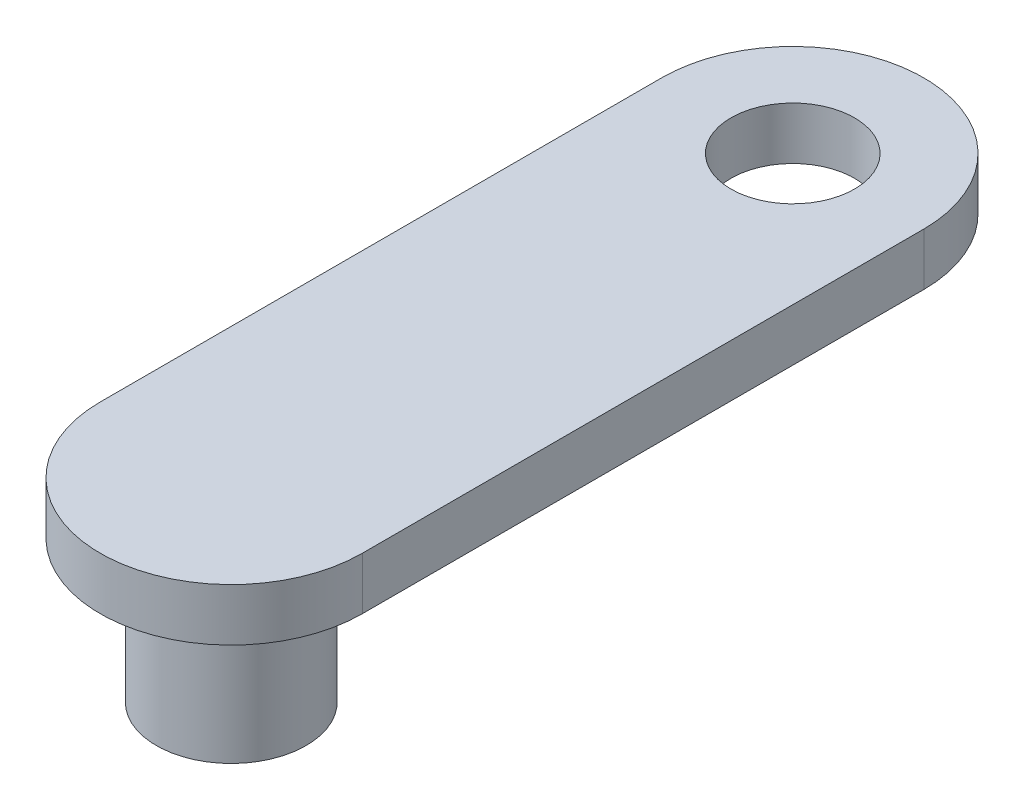
from build123d import *

# Parameters (mm, degrees)
SKETCH_1_R      = 2
EXTRUDE_1_DEPTH = 3.8
SKETCH_2_R      = 1.65
EXTRUDE_2_DEPTH = 1.4


with BuildPart() as part:
    # 草图1 → 凸台-拉伸1 (new body)
    with BuildSketch(Plane(origin=(0, 0, 0), x_dir=(1, 0, 0), z_dir=(0, 1, 0))):
        with Locations(Location((0, 0, 0), (0, 0, 90))):
            Circle(SKETCH_1_R)
    extrude(amount=EXTRUDE_1_DEPTH)

    # 草图2 → 凸台-拉伸2 (add)
    with BuildSketch(Plane(origin=(0, 3.8, 0), x_dir=(1, 0, 0), z_dir=(0, 1, 0))):
        with BuildLine():
            Line((-3.5, 0), (-3.5, 15))
            ThreePointArc((-3.5, 15), (0, 18.5), (3.5, 15))
            Line((3.5, 15), (3.5, 0))
            ThreePointArc((3.5, 0), (0, -3.5), (-3.5, 0))
        make_face()
        with Locations(Location((0, 15, 0), (0, 0, 270))):
            Circle(SKETCH_2_R, mode=Mode.SUBTRACT)
    extrude(amount=EXTRUDE_2_DEPTH)


solid = part.part
